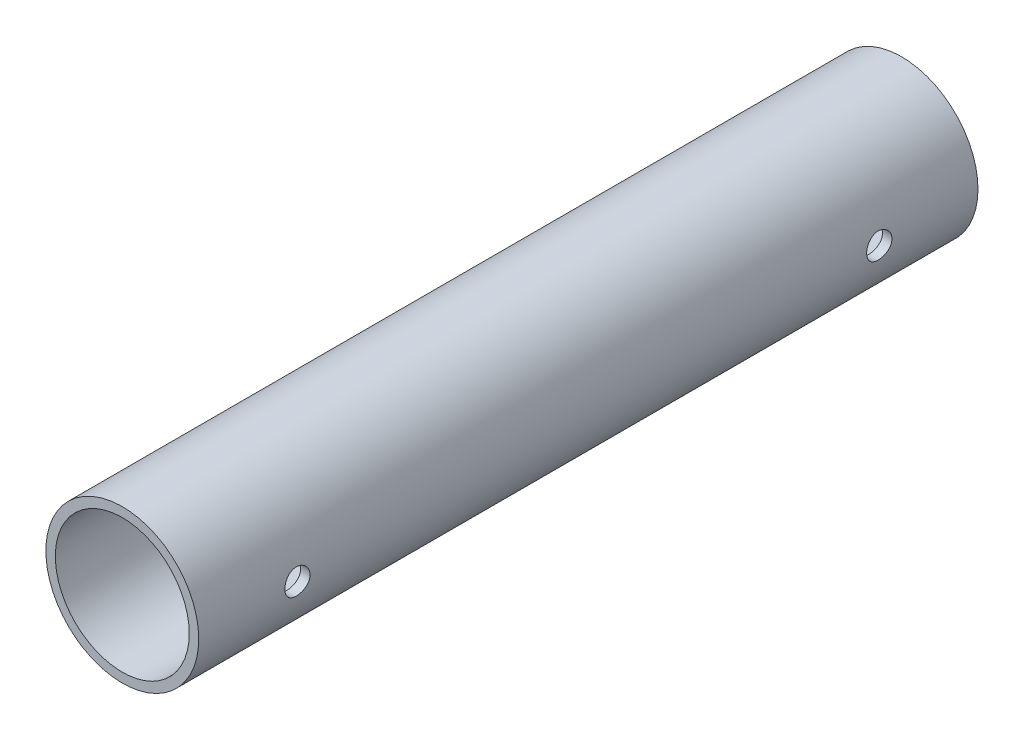
from build123d import *

# Parameters (mm, degrees)
SKETCH1_R           = 12.1
SKETCH1_R_2         = 10.6
BOSS_EXTRUDE1_DEPTH = 61.68
SKETCH2_R           = 2
CUT_EXTRUDE1_DEPTH  = 65.009705514


with BuildPart() as part:
    # Sketch1 → Boss-Extrude1 (new body)
    with BuildSketch(Plane.XY):
        with Locations(Location((0, 0, 0), (0, 0, 180))):
            Circle(SKETCH1_R)
        with Locations(Location((0, 0, 0), (0, 0, 180))):
            Circle(SKETCH1_R_2, mode=Mode.SUBTRACT)
    boss_extrude1 = extrude(amount=BOSS_EXTRUDE1_DEPTH)

    # Sketch2 → Cut-Extrude1 (cut, symmetric)
    with BuildSketch(Plane(origin=(0, 0, 0), x_dir=(0, 0, -1), z_dir=(1, 0, 0))):
        with Locations((-46.055, 0)):
            Circle(SKETCH2_R)
    cut_extrude1 = extrude(amount=CUT_EXTRUDE1_DEPTH, both=True, mode=Mode.SUBTRACT)

    # Mirror1: Boss-Extrude1, Cut-Extrude1 across plane
    add(boss_extrude1.mirror(Plane.XY))
    add(cut_extrude1.mirror(Plane.XY), mode=Mode.SUBTRACT)


solid = part.part
